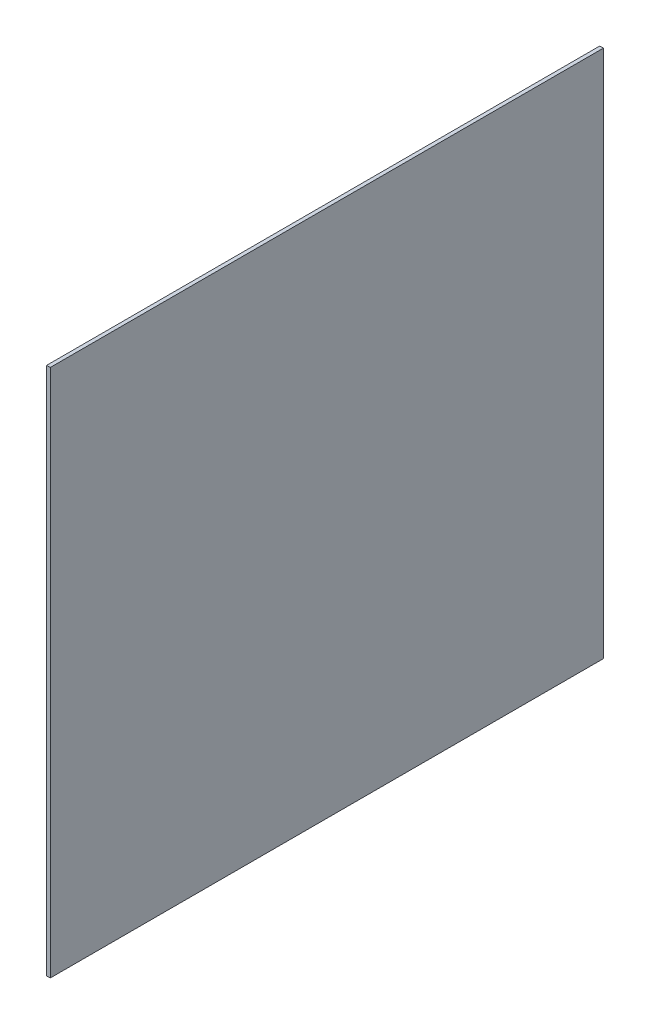
from build123d import *

# Parameters (mm, degrees)
SKETCH1_W           = 454
SKETCH1_H           = 434
BOSS_EXTRUDE1_DEPTH = 3


with BuildPart() as part:
    # Sketch1 → Boss-Extrude1 (new body)
    with BuildSketch(Plane(origin=(0, 0, 0), x_dir=(0, 0, -1), z_dir=(1, 0, 0))):
        Rectangle(SKETCH1_W, SKETCH1_H)
    extrude(amount=BOSS_EXTRUDE1_DEPTH)


solid = part.part
